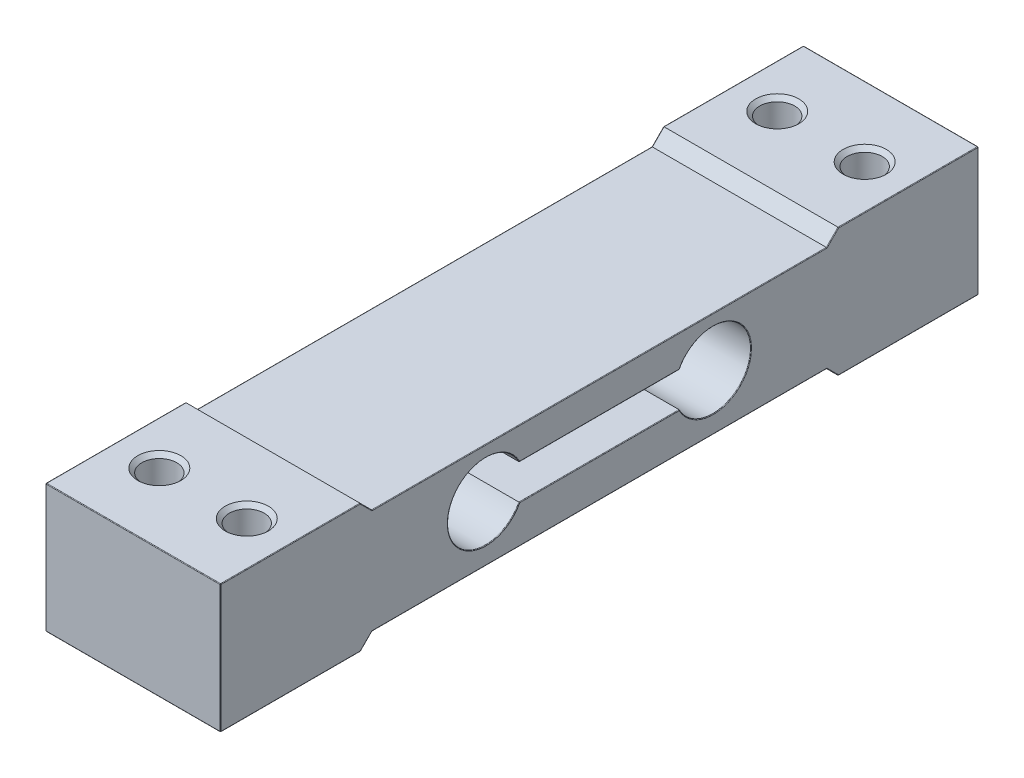
from build123d import *

# Parameters (mm, degrees)
EXTRUDE_1_DEPTH      = 15
EXTRUDE_1_DEPTH_BACK = 15
CUT_EXTRUDE_1_DEPTH  = 45
SKETCH_12_R          = 3
CUT_EXTRUDE_2_DEPTH  = 40
CHAMFER_1_SIZE       = 0.7
FILLET_1_R           = 0.1
SKETCH_13_R          = 1.75
CUT_EXTRUDE_3_DEPTH  = 10
SKETCH_15_R          = 1.75
EXTRUDE_2_DEPTH      = 15


with BuildPart() as part:
    # Эскиз1 → Бобышка-Вытянуть1 (new, two sides: drawn at the far end of the back side and taken through both)
    with BuildSketch(Plane(origin=(0, 0, 0), x_dir=(0, 0, -1), z_dir=(1, 0, 0)).offset(-EXTRUDE_1_DEPTH_BACK)):
        Polygon((24, 22), (26, 20), (104, 20), (106, 22), (130, 22), (130, 0), (106, 0), (104, 2), (26, 2), (24, 0), (0, 0), (0, 22), align=None)
    extrude(amount=EXTRUDE_1_DEPTH + EXTRUDE_1_DEPTH_BACK)

    # Эскиз2 → Вырез-Вытянуть1 (cut)
    with BuildSketch(Plane(origin=(15, 0, 0), x_dir=(0, 0, -1), z_dir=(1, 0, 0))):
        with BuildLine():
            Line((51.266281297, 14.526622722), (78.733718703, 14.526622722))
            ThreePointArc((78.733718703, 14.526622722), (91, 11.526622722), (78.733718703, 8.526622722))
            Line((78.733718703, 8.526622722), (51.266281297, 8.526622722))
            ThreePointArc((51.266281297, 8.526622722), (39, 11.526622722), (51.266281297, 14.526622722))
        make_face()
    extrude(amount=-CUT_EXTRUDE_1_DEPTH, mode=Mode.SUBTRACT)

    # Эскиз12 → Вырез-Вытянуть2 (cut)
    with BuildSketch(Plane.XZ):
        with Locations((7.5, -118)):
            Circle(SKETCH_12_R)
        with Locations((-7.5, -118)):
            Circle(SKETCH_12_R)
        with Locations((7.5, -12)):
            Circle(SKETCH_12_R)
        with Locations((-7.5, -12)):
            Circle(SKETCH_12_R)
    extrude(amount=-CUT_EXTRUDE_2_DEPTH, mode=Mode.SUBTRACT)

    # Фаска1
    chamfer_1_edges = [part.edges().sort_by_distance(p)[0] for p in [
        (-10.5, 0, -118),
        (-10.5, 22, -118),
        (4.5, 0, -118),
        (4.5, 22, -118),
        (4.5, 0, -12),
        (4.5, 22, -12),
        (-10.5, 0, -12),
        (-10.5, 22, -12),
    ]]
    chamfer(chamfer_1_edges, length=CHAMFER_1_SIZE)

    # Скругление1
    fillet_1_edges = [part.edges().sort_by_distance(p)[0] for p in [
        (-15, 0, -118),
        (-15, 22, -118),
        (-15, 21, -105),
        (-15, 20, -65),
        (-15, 21, -25),
        (-15, 22, -12),
        (-15, 0, -12),
        (-15, 1, -25),
        (-15, 2, -65),
        (-15, 1, -105),
        (-15, 11.526622722, -39),
        (-15, 14.526622722, -65),
        (-15, 11.526622722, -91),
        (-15, 8.526622722, -65),
        (-15, 11, -130),
        (0, 0, -130),
        (0, 22, -130),
        (-15, 11, 0),
        (0, 22, 0),
        (0, 0, 0),
        (15, 2, -65),
        (15, 1, -25),
        (15, 0, -12),
        (15, 11, 0),
        (15, 22, -12),
        (15, 21, -25),
        (15, 20, -65),
        (15, 21, -105),
        (15, 22, -118),
        (15, 11, -130),
        (15, 0, -118),
        (15, 1, -105),
        (15, 14.526622722, -65),
        (15, 11.526622722, -39),
        (15, 8.526622722, -65),
        (15, 11.526622722, -91),
    ]]
    fillet(fillet_1_edges, radius=FILLET_1_R)

    # Эскиз13 → Вырез-Вытянуть3 (cut)
    with BuildSketch(Plane.ZY.offset(15)):
        with Locations((-123.9, 11)):
            Circle(SKETCH_13_R)
    extrude(amount=-CUT_EXTRUDE_3_DEPTH, mode=Mode.SUBTRACT)


with BuildPart() as body_2:
    # Эскиз15 → Бобышка-Вытянуть2 (new body)
    with BuildSketch(Plane.ZY.offset(5)):
        with Locations((-123.9, 11)):
            Circle(SKETCH_15_R)
    extrude(amount=EXTRUDE_2_DEPTH)


solid = Compound([part.part, body_2.part])
